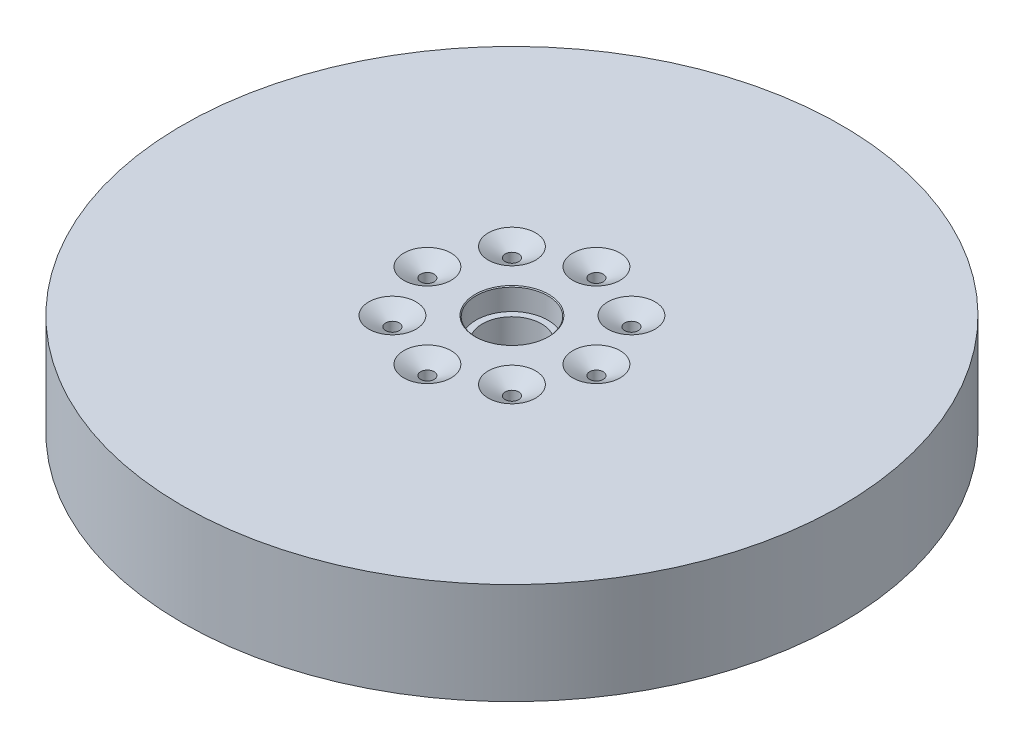
from build123d import *
from OCP.BRepFilletAPI import BRepFilletAPI_MakeChamfer

# Parameters (mm, degrees)
CUT_EXTRUDE1_DEPTH      = 286.527581855
CUT_EXTRUDE1_DEPTH_BACK = 286.527581855
SKETCH2_R               = 4
BOSS_EXTRUDE1_START     = 30
SKETCH5_R               = 74.5
SKETCH5_R_2             = 4
SKETCH5_R_3             = 17.5
BOSS_EXTRUDE1_DEPTH     = 1
SKETCH6_R               = 74.5
CUT_EXTRUDE4_DEPTH      = 2.5
CHAMFER1_SIZE           = 5
CHAMFER1_SIZE2          = 8.660254038
CHAMFER2_SIZE           = 10
CHAMFER2_SIZE2          = 5.773502692
BOSS_EXTRUDE3_START     = 0.01
SKETCH7_R               = 2.6
BOSS_EXTRUDE3_DEPTH     = 5
SKETCH8_R               = 2.6
BOSS_EXTRUDE4_DEPTH     = 5
CHAMFER3_SIZE           = 3.5
CHAMFER4_SIZE           = 3.5
SKETCH9_R               = 2.6
CUT_EXTRUDE5_DEPTH      = 15
CUT_EXTRUDE6_DEPTH      = 10
CIRPATTERN5_COUNT       = 4
BOSS_EXTRUDE5_START     = 0.01
BOSS_EXTRUDE5_DEPTH     = 10
CHAMFER5_SIZE           = 3.5
CHAMFER6_SIZE           = 3.5


with BuildPart() as part:
    # Sketch1 → Revolve1 (revolve)
    with BuildSketch(Plane(origin=(0, 0, 0), x_dir=(0, 0, -1), z_dir=(1, 0, 0))):
        Polygon((-195, 60), (-195, 0), (-185.5, 0), (-185.5, 10), (-74.5, 10), (-74.5, 0), (-74.5, -14), (-20, -14), (-17.5, -11.5), (-17.5, 47), (-21.25, 47), (-21.25, 59.5), (-21.75, 60), (-74.5, 60), (-185.5, 60), align=None)
    revolve(axis=Axis((0, -14, 0), (0, -1, 0)))

    # Sketch2 → Cut-Extrude1 (cut, two sides: drawn at the far end of the back side and taken through both)
    with BuildSketch(Plane(origin=(0, 60, 0), x_dir=(1, 0, 0), z_dir=(0, 1, 0)).offset(-CUT_EXTRUDE1_DEPTH_BACK)):
        with Locations(Location((-50, 0, 0), (0, 0, 270))):
            Circle(SKETCH2_R)
        with Locations(Location((-35.355339059, 35.355339059, 0), (0, 0, 270))):
            Circle(SKETCH2_R)
        with Locations(Location((0, 50, 0), (0, 0, 270))):
            Circle(SKETCH2_R)
        with Locations(Location((35.355339059, 35.355339059, 0), (0, 0, 270))):
            Circle(SKETCH2_R)
        with Locations(Location((50, 0, 0), (0, 0, 270))):
            Circle(SKETCH2_R)
        with Locations(Location((35.355339059, -35.355339059, 0), (0, 0, 270))):
            Circle(SKETCH2_R)
        with Locations(Location((0, -50, 0), (0, 0, 270))):
            Circle(SKETCH2_R)
        with Locations(Location((-35.355339059, -35.355339059, 0), (0, 0, 270))):
            Circle(SKETCH2_R)
    extrude(amount=CUT_EXTRUDE1_DEPTH + CUT_EXTRUDE1_DEPTH_BACK, mode=Mode.SUBTRACT)

    # Sketch6 → Cut-Extrude4 (cut)
    with BuildSketch(Plane.XZ.offset(14)):
        with Locations(Location((0, 0, 0), (0, 0, 270))):
            Circle(SKETCH6_R)
    extrude(amount=-CUT_EXTRUDE4_DEPTH, mode=Mode.SUBTRACT)

    # Chamfer1: one chamfer whose edges measure the first distance from different faces: ONE call of the kernel's chamfer builder (chamfer() names one face for all edges)
    chamfer1_edges_1 = [part.edges().sort_by_distance(p)[0] for p in [
        (-35.355339059, -11.5, 31.355339059),
    ]]
    chamfer1_side_1 = [part.faces().sort_by_distance(p)[0] for p in [
        (-35.355339059, 24.25, 31.355339059),
    ]]
    chamfer1_edges_2 = [part.edges().sort_by_distance(p)[0] for p in [
        (0, -11.5, 46),
    ]]
    chamfer1_side_2 = [part.faces().sort_by_distance(p)[0] for p in [
        (0, 24.25, 46),
    ]]
    chamfer1_edges_3 = [part.edges().sort_by_distance(p)[0] for p in [
        (35.355339059, -11.5, 31.355339059),
    ]]
    chamfer1_side_3 = [part.faces().sort_by_distance(p)[0] for p in [
        (35.355339059, 24.25, 31.355339059),
    ]]
    chamfer1_edges_4 = [part.edges().sort_by_distance(p)[0] for p in [
        (50, -11.5, -4),
    ]]
    chamfer1_side_4 = [part.faces().sort_by_distance(p)[0] for p in [
        (50, 24.25, -4),
    ]]
    chamfer1_edges_5 = [part.edges().sort_by_distance(p)[0] for p in [
        (35.355339059, -11.5, -39.355339059),
    ]]
    chamfer1_side_5 = [part.faces().sort_by_distance(p)[0] for p in [
        (35.355339059, 24.25, -39.355339059),
    ]]
    chamfer1_edges_6 = [part.edges().sort_by_distance(p)[0] for p in [
        (0, -11.5, -54),
    ]]
    chamfer1_side_6 = [part.faces().sort_by_distance(p)[0] for p in [
        (0, 24.25, -54),
    ]]
    chamfer1_edges_7 = [part.edges().sort_by_distance(p)[0] for p in [
        (-35.355339059, -11.5, -39.355339059),
    ]]
    chamfer1_side_7 = [part.faces().sort_by_distance(p)[0] for p in [
        (-35.355339059, 24.25, -39.355339059),
    ]]
    chamfer1_edges_8 = [part.edges().sort_by_distance(p)[0] for p in [
        (-50, -11.5, -4),
    ]]
    chamfer1_side_8 = [part.faces().sort_by_distance(p)[0] for p in [
        (-50, 24.25, -4),
    ]]
    chamfer1 = BRepFilletAPI_MakeChamfer(part.part.solid().wrapped)
    for e in chamfer1_edges_1:
        chamfer1.Add(CHAMFER1_SIZE, CHAMFER1_SIZE2, e.wrapped, chamfer1_side_1[0].wrapped)  # the first distance lies on this face
    for e in chamfer1_edges_2:
        chamfer1.Add(CHAMFER1_SIZE, CHAMFER1_SIZE2, e.wrapped, chamfer1_side_2[0].wrapped)  # the first distance lies on this face
    for e in chamfer1_edges_3:
        chamfer1.Add(CHAMFER1_SIZE, CHAMFER1_SIZE2, e.wrapped, chamfer1_side_3[0].wrapped)  # the first distance lies on this face
    for e in chamfer1_edges_4:
        chamfer1.Add(CHAMFER1_SIZE, CHAMFER1_SIZE2, e.wrapped, chamfer1_side_4[0].wrapped)  # the first distance lies on this face
    for e in chamfer1_edges_5:
        chamfer1.Add(CHAMFER1_SIZE, CHAMFER1_SIZE2, e.wrapped, chamfer1_side_5[0].wrapped)  # the first distance lies on this face
    for e in chamfer1_edges_6:
        chamfer1.Add(CHAMFER1_SIZE, CHAMFER1_SIZE2, e.wrapped, chamfer1_side_6[0].wrapped)  # the first distance lies on this face
    for e in chamfer1_edges_7:
        chamfer1.Add(CHAMFER1_SIZE, CHAMFER1_SIZE2, e.wrapped, chamfer1_side_7[0].wrapped)  # the first distance lies on this face
    for e in chamfer1_edges_8:
        chamfer1.Add(CHAMFER1_SIZE, CHAMFER1_SIZE2, e.wrapped, chamfer1_side_8[0].wrapped)  # the first distance lies on this face
    add(Compound.cast(chamfer1.Shape()), mode=Mode.REPLACE)

    # Chamfer2
    chamfer2_edges = [part.edges().sort_by_distance(p)[0] for p in [
        (-50, 60, -4),
        (-35.355339059, 60, -39.355339059),
        (0, 60, -54),
        (35.355339059, 60, -39.355339059),
        (50, 60, -4),
        (35.355339059, 60, 31.355339059),
        (0, 60, 46),
        (-35.355339059, 60, 31.355339059),
    ]]
    chamfer2_side = [part.faces().sort_by_distance(p)[0] for p in [
        (0, 60, -189.484567107),
    ]]
    chamfer(chamfer2_edges, length=CHAMFER2_SIZE, length2=CHAMFER2_SIZE2, reference=chamfer2_side[0])

    # Sketch9 → Cut-Extrude5 (cut)
    with BuildSketch(Plane.XZ.offset(-10)):
        with Locations(Location((0, 157, 0), (0, 0, 270))):
            Circle(SKETCH9_R)
        with Locations(Location((0, -157, 0), (0, 0, 270))):
            Circle(SKETCH9_R)
        with Locations(Location((0, 102, 0), (0, 0, 270))):
            Circle(SKETCH9_R)
        with Locations(Location((60.081298881, 145.049086604, 0), (0, 0, 270))):
            Circle(SKETCH9_R)
        with Locations(Location((39.033710101, 94.235712316, 0), (0, 0, 270))):
            Circle(SKETCH9_R)
        with Locations(Location((111.015764646, 111.015764646, 0), (0, 0, 270))):
            Circle(SKETCH9_R)
        with Locations(Location((72.124891681, 72.124891681, 0), (0, 0, 270))):
            Circle(SKETCH9_R)
        with Locations(Location((145.049086604, 60.081298881, 0), (0, 0, 270))):
            Circle(SKETCH9_R)
        with Locations(Location((94.235712316, 39.033710101, 0), (0, 0, 270))):
            Circle(SKETCH9_R)
        with Locations(Location((157, 0, 0), (0, 0, 270))):
            Circle(SKETCH9_R)
        with Locations(Location((102, 0, 0), (0, 0, 270))):
            Circle(SKETCH9_R)
        with Locations(Location((145.049086604, -60.081298881, 0), (0, 0, 270))):
            Circle(SKETCH9_R)
        with Locations(Location((94.235712316, -39.033710101, 0), (0, 0, 270))):
            Circle(SKETCH9_R)
        with Locations(Location((111.015764646, -111.015764646, 0), (0, 0, 270))):
            Circle(SKETCH9_R)
        with Locations(Location((72.124891681, -72.124891681, 0), (0, 0, 270))):
            Circle(SKETCH9_R)
        with Locations(Location((60.081298881, -145.049086604, 0), (0, 0, 270))):
            Circle(SKETCH9_R)
        with Locations(Location((39.033710101, -94.235712316, 0), (0, 0, 270))):
            Circle(SKETCH9_R)
        with Locations(Location((0, -102, 0), (0, 0, 270))):
            Circle(SKETCH9_R)
        with Locations(Location((-60.081298881, -145.049086604, 0), (0, 0, 270))):
            Circle(SKETCH9_R)
        with Locations(Location((-39.033710101, -94.235712316, 0), (0, 0, 270))):
            Circle(SKETCH9_R)
        with Locations(Location((-111.015764646, -111.015764646, 0), (0, 0, 270))):
            Circle(SKETCH9_R)
        with Locations(Location((-72.124891681, -72.124891681, 0), (0, 0, 270))):
            Circle(SKETCH9_R)
        with Locations(Location((-145.049086604, -60.081298881, 0), (0, 0, 270))):
            Circle(SKETCH9_R)
        with Locations(Location((-94.235712316, -39.033710101, 0), (0, 0, 270))):
            Circle(SKETCH9_R)
        with Locations(Location((-157, 0, 0), (0, 0, 270))):
            Circle(SKETCH9_R)
        with Locations(Location((-102, 0, 0), (0, 0, 270))):
            Circle(SKETCH9_R)
        with Locations(Location((-145.049086604, 60.081298881, 0), (0, 0, 270))):
            Circle(SKETCH9_R)
        with Locations(Location((-94.235712316, 39.033710101, 0), (0, 0, 270))):
            Circle(SKETCH9_R)
        with Locations(Location((-111.015764646, 111.015764646, 0), (0, 0, 270))):
            Circle(SKETCH9_R)
        with Locations(Location((-72.124891681, 72.124891681, 0), (0, 0, 270))):
            Circle(SKETCH9_R)
        with Locations(Location((-60.081298881, 145.049086604, 0), (0, 0, 270))):
            Circle(SKETCH9_R)
        with Locations(Location((-39.033710101, 94.235712316, 0), (0, 0, 270))):
            Circle(SKETCH9_R)
    extrude(amount=-CUT_EXTRUDE5_DEPTH, mode=Mode.SUBTRACT)


with BuildPart() as body_2:
    # Sketch5 → Boss-Extrude1 (new body)
    with BuildSketch(Plane.XZ.offset(14).offset(BOSS_EXTRUDE1_START)):
        with Locations(Location((0, 0, 0), (0, 0, 270))):
            Circle(SKETCH5_R)
        with Locations(Location((35.355339059, -35.355339059, 0), (0, 0, 270))):
            Circle(SKETCH5_R_2, mode=Mode.SUBTRACT)
        with Locations(Location((0, -50, 0), (0, 0, 270))):
            Circle(SKETCH5_R_2, mode=Mode.SUBTRACT)
        with Locations(Location((-35.355339059, -35.355339059, 0), (0, 0, 270))):
            Circle(SKETCH5_R_2, mode=Mode.SUBTRACT)
        with Locations(Location((-50, 0, 0), (0, 0, 270))):
            Circle(SKETCH5_R_2, mode=Mode.SUBTRACT)
        with Locations(Location((50, 0, 0), (0, 0, 270))):
            Circle(SKETCH5_R_2, mode=Mode.SUBTRACT)
        with Locations(Location((35.355339059, 35.355339059, 0), (0, 0, 270))):
            Circle(SKETCH5_R_2, mode=Mode.SUBTRACT)
        with Locations(Location((-35.355339059, 35.355339059, 0), (0, 0, 270))):
            Circle(SKETCH5_R_2, mode=Mode.SUBTRACT)
        with Locations(Location((0, 50, 0), (0, 0, 270))):
            Circle(SKETCH5_R_2, mode=Mode.SUBTRACT)
        with Locations(Location((0, 0, 0), (0, 0, 270))):
            Circle(SKETCH5_R_3, mode=Mode.SUBTRACT)
    extrude(amount=BOSS_EXTRUDE1_DEPTH)


with BuildPart() as body_3:
    # Sketch7 → Boss-Extrude3 (new body)
    with BuildSketch(Plane.XZ.offset(-10).offset(BOSS_EXTRUDE3_START)):
        with BuildLine():
            Line((14.141056357, 73.654806531), (35.406094076, 180.56137046))
            ThreePointArc((35.406094076, 180.56137046), (0, 184), (-35.406094076, 180.56137046))
            Line((-35.406094076, 180.56137046), (-14.141056357, 73.654806531))
            ThreePointArc((-14.141056357, 73.654806531), (0, 75), (14.141056357, 73.654806531))
        make_face()
        with Locations(Location((0, 157, 0), (0, 0, 270))):
            Circle(SKETCH7_R, mode=Mode.SUBTRACT)
        with Locations(Location((0, 102, 0), (0, 0, 90))):
            Circle(SKETCH7_R, mode=Mode.SUBTRACT)
    extrude(amount=BOSS_EXTRUDE3_DEPTH)

    # Chamfer4
    chamfer4_edges = [body_3.edges().sort_by_distance(p)[0] for p in [
        (0, 9.99, 159.6),
        (0, 9.99, 99.4),
    ]]
    chamfer(chamfer4_edges, length=CHAMFER4_SIZE)


with BuildPart() as body_4:
    # Sketch8 → Boss-Extrude4 (new body)
    with BuildSketch(Plane.XZ.offset(-4.99)):
        with BuildLine():
            Line((14.141056357, 73.654806531), (35.406094076, 180.56137046))
            ThreePointArc((35.406094076, 180.56137046), (0, 184), (-35.406094076, 180.56137046))
            Line((-35.406094076, 180.56137046), (-14.141056357, 73.654806531))
            ThreePointArc((-14.141056357, 73.654806531), (0, 75), (14.141056357, 73.654806531))
        make_face()
        with Locations(Location((0, 102, 0), (0, 0, 270))):
            Circle(SKETCH8_R, mode=Mode.SUBTRACT)
        with Locations(Location((0, 157, 0), (0, 0, 270))):
            Circle(SKETCH8_R, mode=Mode.SUBTRACT)
    extrude(amount=BOSS_EXTRUDE4_DEPTH)

    # Chamfer3
    chamfer3_edges = [body_4.edges().sort_by_distance(p)[0] for p in [
        (0, -0.01, 104.6),
        (0, -0.01, 159.6),
    ]]
    chamfer(chamfer3_edges, length=CHAMFER3_SIZE)


with BuildPart() as cut_extrude6_tool:
    # Sketch10 → Cut-Extrude6 (new body)
    with BuildSketch(Plane.XZ.offset(0.01)):
        Polygon((-30.524821078, 78.083699281), (15.022017899, 78.083699281), (14.141056357, 73.654806531), (-14.141056357, 73.654806531), align=None)
    extrude(amount=-CUT_EXTRUDE6_DEPTH)


with BuildPart() as body_4_1:
    add(body_4.part)

    # Cut-Extrude6: cut by cut_extrude6_tool
    add(cut_extrude6_tool.part, mode=Mode.SUBTRACT)


with BuildPart() as body_3_1:
    add(body_3.part)

    # Cut-Extrude6: cut by cut_extrude6_tool
    add(cut_extrude6_tool.part, mode=Mode.SUBTRACT)


with BuildPart() as cirpattern5_1:
    # CirPattern5: pattern copy
    add(body_4_1.part.rotate(Axis((0, 0, 0), (0, 1, 0)), 1 * 360 / CIRPATTERN5_COUNT))


with BuildPart() as cirpattern5_2:
    # CirPattern5: pattern copy
    add(body_4_1.part.rotate(Axis((0, 0, 0), (0, 1, 0)), 2 * 360 / CIRPATTERN5_COUNT))


with BuildPart() as cirpattern5_3:
    # CirPattern5: pattern copy
    add(body_4_1.part.rotate(Axis((0, 0, 0), (0, 1, 0)), 3 * 360 / CIRPATTERN5_COUNT))


with BuildPart() as cirpattern5_4:
    # CirPattern5: pattern copy
    add(body_3_1.part.rotate(Axis((0, 0, 0), (0, 1, 0)), 1 * 360 / CIRPATTERN5_COUNT))


with BuildPart() as cirpattern5_5:
    # CirPattern5: pattern copy
    add(body_3_1.part.rotate(Axis((0, 0, 0), (0, 1, 0)), 2 * 360 / CIRPATTERN5_COUNT))


with BuildPart() as cirpattern5_6:
    # CirPattern5: pattern copy
    add(body_3_1.part.rotate(Axis((0, 0, 0), (0, 1, 0)), 3 * 360 / CIRPATTERN5_COUNT))


with BuildPart() as body_11:
    # Sketch11 → Boss-Extrude5 (new body)
    with BuildSketch(Plane.XZ.offset(-10).offset(BOSS_EXTRUDE5_START)):
        with BuildLine():
            Line((15.851771263, 77.951168427), (36.229696886, 180.397918678))
            ThreePointArc((36.229696886, 180.397918678), (53.57487768, 176.027646924), (70.413751555, 169.993833982))
            Line((70.413751555, 169.993833982), (61.076275805, 147.451173389))
            ThreePointArc((61.076275805, 147.451173389), (57.679212097, 146.044063528), (59.086321957, 142.64699982))
            Line((59.086321957, 142.64699982), (40.028687025, 96.637799101))
            ThreePointArc((40.028687025, 96.637799101), (36.631623317, 95.23068924), (38.038733177, 91.833625532))
            Line((38.038733177, 91.833625532), (29.881338053, 72.139931589))
            Line((29.881338053, 72.139931589), (15.851771263, 77.951168427))
        make_face()
    extrude(amount=BOSS_EXTRUDE5_DEPTH)

    # Chamfer5
    chamfer5_edges = [body_11.edges().sort_by_distance(p)[0] for p in [
        (57.679212097, -0.01, 146.044063528),
        (36.631623317, -0.01, 95.23068924),
    ]]
    chamfer(chamfer5_edges, length=CHAMFER5_SIZE)

    # Chamfer6
    chamfer6_edges = [body_11.edges().sort_by_distance(p)[0] for p in [
        (57.679212097, 9.99, 146.044063528),
        (36.631623317, 9.99, 95.23068924),
    ]]
    chamfer(chamfer6_edges, length=CHAMFER6_SIZE)


solid = Compound([part.part, body_2.part, body_4_1.part, body_3_1.part, cirpattern5_1.part, cirpattern5_2.part, cirpattern5_3.part, cirpattern5_4.part, cirpattern5_5.part, cirpattern5_6.part, body_11.part])
